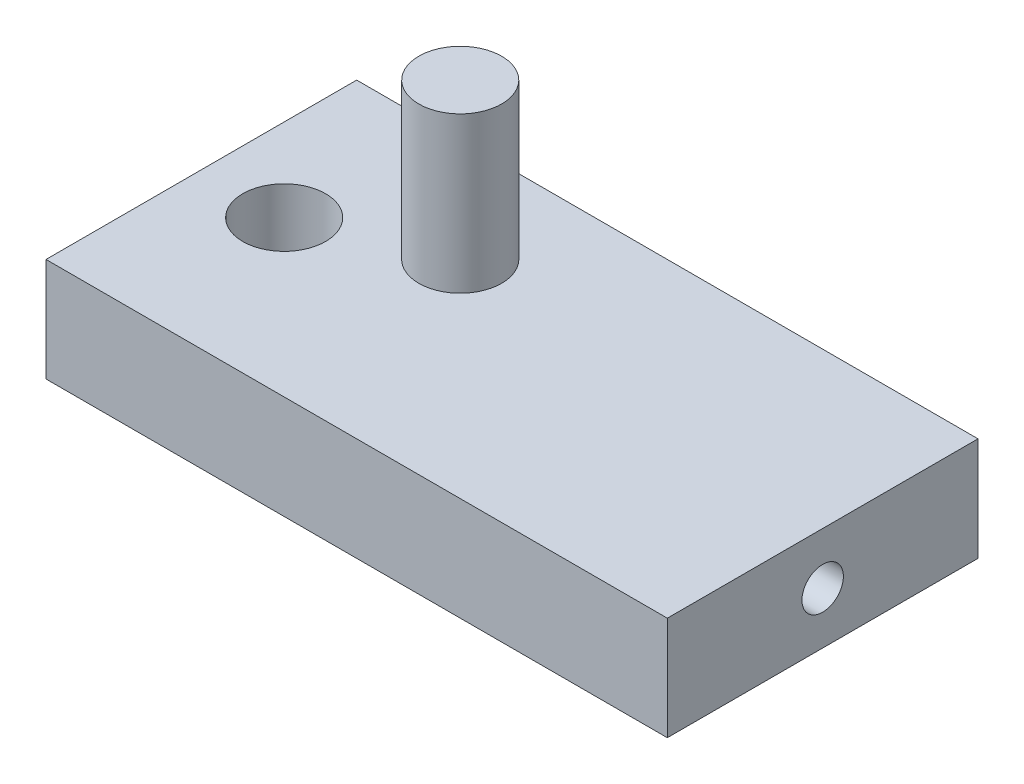
from build123d import *

# Parameters (mm, degrees)
SKETCH1_W                = 30
SKETCH1_H                = 15
SKETCH1_R                = 2
BOSS_EXTRUDE1_DEPTH      = 2.5
BOSS_EXTRUDE2_DEPTH      = 10
BOSS_EXTRUDE2_DEPTH_BACK = 2.5
SKETCH1_3_R              = 2
SKETCH2_R                = 1
CUT_EXTRUDE1_DEPTH       = 10


with BuildPart() as part:
    # Sketch1 → Boss-Extrude1 (new, symmetric)
    with BuildSketch(Plane(origin=(0, 0, 0), x_dir=(1, 0, 0), z_dir=(0, 1, 0))):
        Rectangle(SKETCH1_W, SKETCH1_H)
        with Locations((-11, 0)):
            Circle(SKETCH1_R, mode=Mode.SUBTRACT)
        with Locations((-5, 2.5)):
            Circle(SKETCH1_R, mode=Mode.SUBTRACT)
    extrude(amount=BOSS_EXTRUDE1_DEPTH, both=True)

    # Sketch1<3> → Boss-Extrude2 (add, two sides: drawn at the far end of the back side and taken through both)
    with BuildSketch(Plane(origin=(0, 0, 0), x_dir=(1, 0, 0), z_dir=(0, 1, 0)).offset(-BOSS_EXTRUDE2_DEPTH_BACK)):
        with Locations((-5, 2.5)):
            Circle(SKETCH1_3_R)
    extrude(amount=BOSS_EXTRUDE2_DEPTH + BOSS_EXTRUDE2_DEPTH_BACK)

    # Sketch2 → Cut-Extrude1 (cut)
    with BuildSketch(Plane(origin=(15, 0, 0), x_dir=(0, 0, -1), z_dir=(1, 0, 0))):
        Circle(SKETCH2_R)
    extrude(amount=-CUT_EXTRUDE1_DEPTH, mode=Mode.SUBTRACT)


solid = part.part
